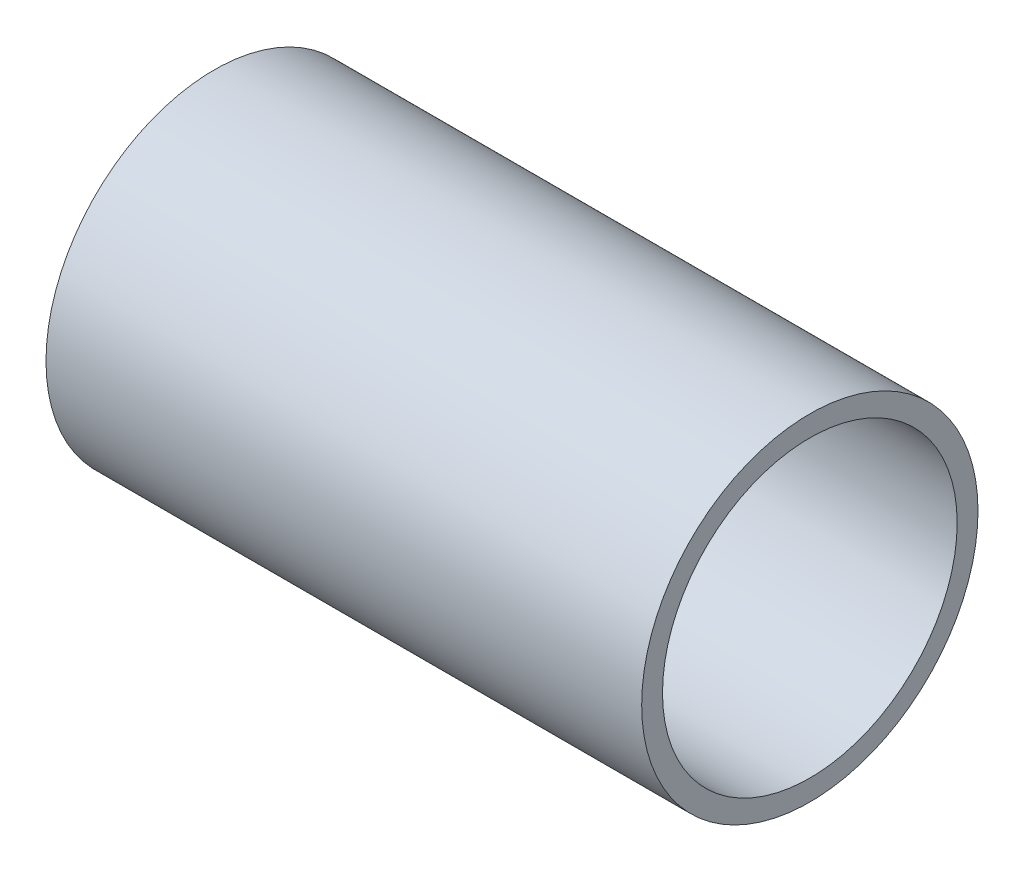
from build123d import *

# Parameters (mm, degrees)
CROQUIS1_R              = 64.0875
CROQUIS1_R_2            = 56.15
SALIENTE_EXTRUIR1_DEPTH = 227.0125


with BuildPart() as part:
    # Croquis1 → Saliente-Extruir1 (new body)
    with BuildSketch(Plane(origin=(0, 0, 0), x_dir=(0, 0, -1), z_dir=(1, 0, 0))):
        Circle(CROQUIS1_R)
        Circle(CROQUIS1_R_2, mode=Mode.SUBTRACT)
    extrude(amount=SALIENTE_EXTRUIR1_DEPTH)


solid = part.part
